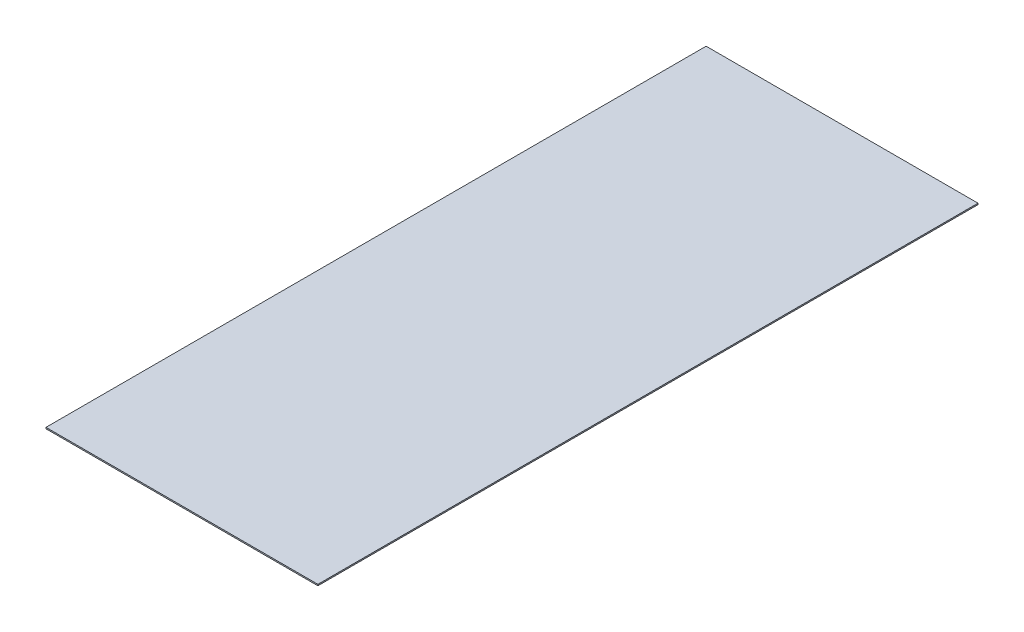
from build123d import *

# Parameters (mm, degrees)
ESBO_O1_W                = 416
ESBO_O1_H                = 2
RESSALTO_EXTRUS_O1_DEPTH = 1010


with BuildPart() as part:
    # Esboço1 → Ressalto-extrusão1 (new body)
    with BuildSketch(Plane.XY):
        Rectangle(ESBO_O1_W, ESBO_O1_H)
    extrude(amount=RESSALTO_EXTRUS_O1_DEPTH)


solid = part.part
